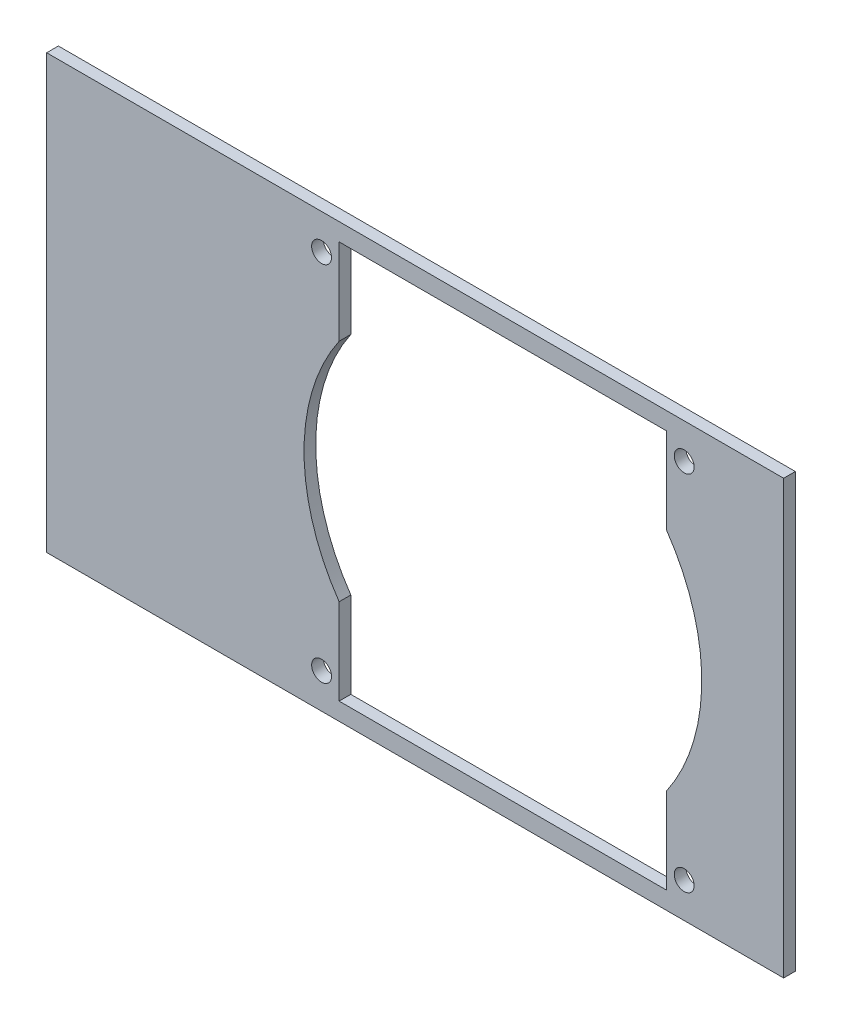
from build123d import *

# Parameters (mm, degrees)
ESBO_O1_W                = 126
ESBO_O1_H                = 74
ESBO_O1_R                = 1.7
RESSALTO_EXTRUS_O1_DEPTH = 2


with BuildPart() as part:
    # Esboço1 → Ressalto-extrusão1 (new body)
    with BuildSketch(Plane.XY):
        with Locations((63, -37)):
            Rectangle(ESBO_O1_W, ESBO_O1_H)
        with Locations((47, -6)):
            Circle(ESBO_O1_R, mode=Mode.SUBTRACT)
        with Locations((109, -6)):
            Circle(ESBO_O1_R, mode=Mode.SUBTRACT)
        with Locations((47, -68)):
            Circle(ESBO_O1_R, mode=Mode.SUBTRACT)
        with Locations((109, -68)):
            Circle(ESBO_O1_R, mode=Mode.SUBTRACT)
        with BuildLine():
            Line((50, -3), (50, -17.712698478))
            ThreePointArc((50, -17.712698478), (44, -37), (50, -56.287301522))
            Line((50, -56.287301522), (50, -71))
            Line((50, -71), (106, -71))
            Line((106, -71), (106, -56.287301522))
            ThreePointArc((106, -56.287301522), (112, -37), (106, -17.712698478))
            Line((106, -17.712698478), (106, -3))
            Line((106, -3), (50, -3))
        make_face(mode=Mode.SUBTRACT)
    extrude(amount=RESSALTO_EXTRUS_O1_DEPTH)


solid = part.part
